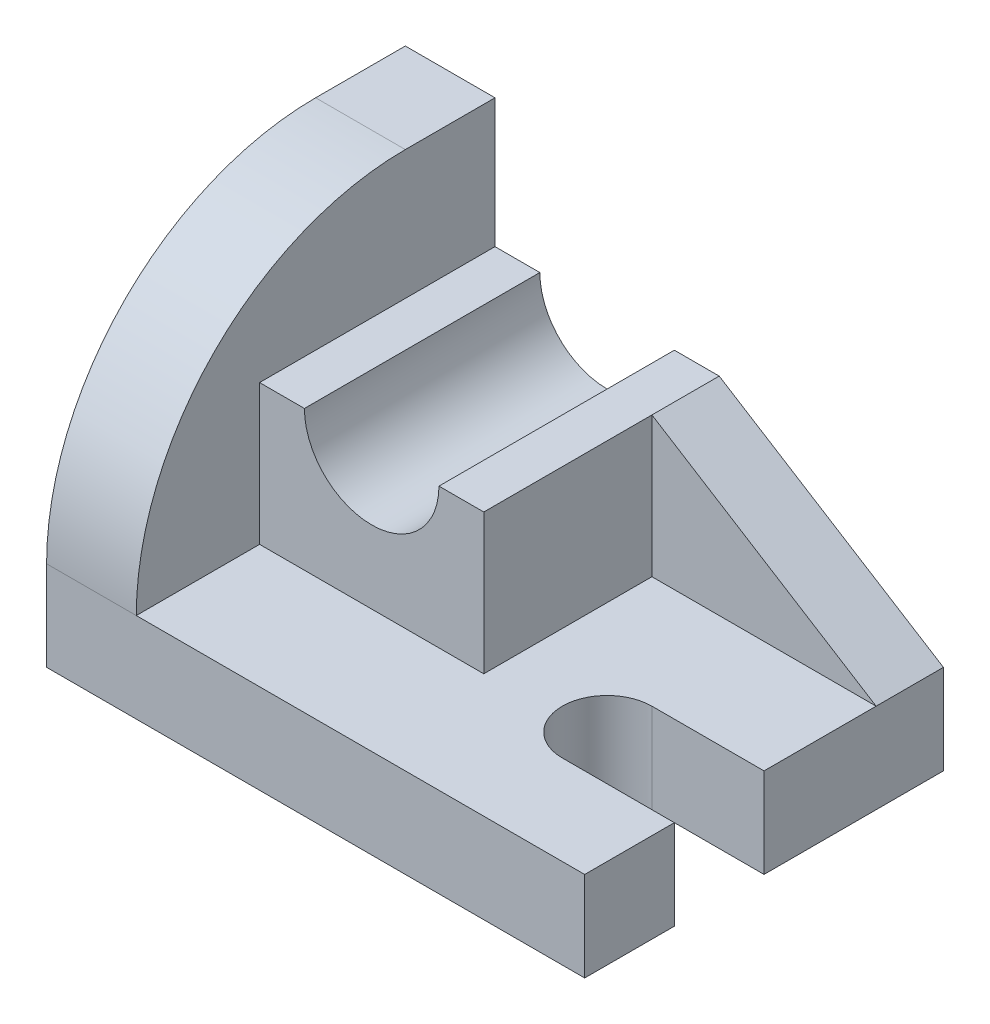
from build123d import *

# Parameters (mm, degrees)
BOSS_EXTRUDE1_DEPTH = 16
BOSS_EXTRUDE2_DEPTH = 16
BOSS_EXTRUDE3_DEPTH = 42
BOSS_EXTRUDE4_DEPTH = 12


with BuildPart() as part:
    # Sketch1 → Boss-Extrude1 (new body)
    with BuildSketch(Plane(origin=(0, 0, 0), x_dir=(1, 0, 0), z_dir=(0, 1, 0))):
        with BuildLine():
            Line((0, 64), (0, 0))
            Line((0, 0), (96, 0))
            Line((96, 0), (96, 16))
            Line((96, 16), (76, 16))
            ThreePointArc((76, 16), (68, 24), (76, 32))
            Line((76, 32), (96, 32))
            Line((96, 32), (96, 64))
            Line((96, 64), (0, 64))
        make_face()
    extrude(amount=BOSS_EXTRUDE1_DEPTH)

    # Sketch2 → Boss-Extrude2 (add)
    with BuildSketch(Plane.ZY):
        with BuildLine():
            Line((0, 0), (-64, 0))
            Line((-64, 0), (-64, 64))
            Line((-64, 64), (-48, 64))
            ThreePointArc((-48, 64), (-14.058874503, 49.941125497), (0, 16))
            Line((0, 16), (0, 0))
        make_face()
    extrude(amount=-BOSS_EXTRUDE2_DEPTH)

    # Sketch3 → Boss-Extrude3 (add)
    with BuildSketch(Plane(origin=(0, 0, -64), x_dir=(-1, 0, 0), z_dir=(0, 0, -1))):
        with BuildLine():
            Line((-56, 16), (-16, 16))
            Line((-16, 16), (-16, 41))
            Line((-16, 41), (-24, 41))
            ThreePointArc((-24, 41), (-36, 29), (-48, 41))
            Line((-48, 41), (-56, 41))
            Line((-56, 41), (-56, 16))
        make_face()
    extrude(amount=-BOSS_EXTRUDE3_DEPTH)

    # Sketch4 → Boss-Extrude4 (add)
    with BuildSketch(Plane(origin=(0, 0, -64), x_dir=(-1, 0, 0), z_dir=(0, 0, -1))):
        Polygon((-96, 16), (-56, 41), (-56, 16), align=None)
    extrude(amount=-BOSS_EXTRUDE4_DEPTH)


solid = part.part
